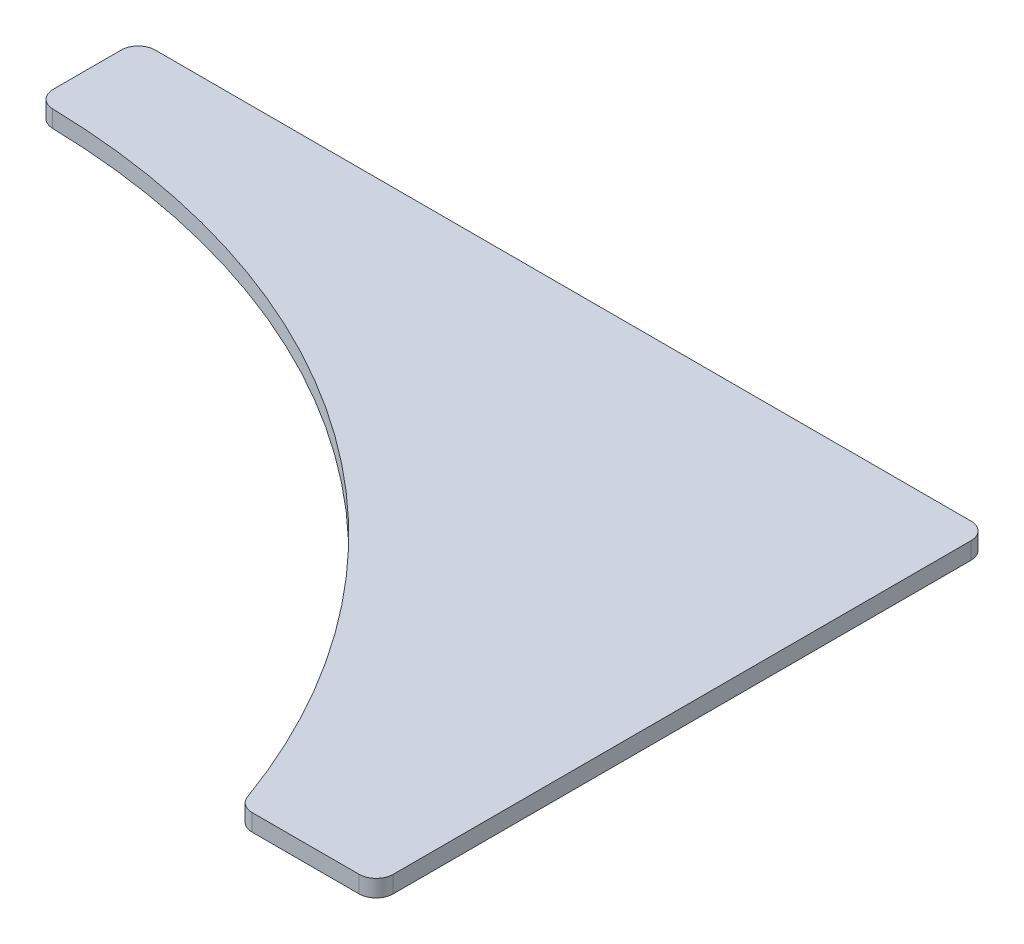
from build123d import *

# Parameters (mm, degrees)
BOSS_EXTRUDE1_DEPTH = 6.35
FILLET1_R           = 6.35


with BuildPart() as part:
    # Sketch1 → Boss-Extrude1 (new body)
    with BuildSketch(Plane(origin=(0, 0, 0), x_dir=(1, 0, 0), z_dir=(0, 1, 0))):
        with BuildLine():
            Line((0, 0), (0, 228.6))
            Line((0, 228.6), (-317.5, 228.6))
            Line((-317.5, 228.6), (-317.5, 190.5))
            ThreePointArc((-317.5, 190.5), (-153.625703663, 137.984014872), (-50.8, 0))
            Line((-50.8, 0), (0, 0))
        make_face()
    extrude(amount=BOSS_EXTRUDE1_DEPTH)

    # Fillet1
    fillet1_edges = [part.edges().sort_by_distance(p)[0] for p in [
        (-50.8, 3.175, 0),
        (-317.5, 3.175, -190.5),
        (-317.5, 3.175, -228.6),
        (0, 3.175, -228.6),
        (0, 3.175, 0),
    ]]
    fillet(fillet1_edges, radius=FILLET1_R)


solid = part.part
